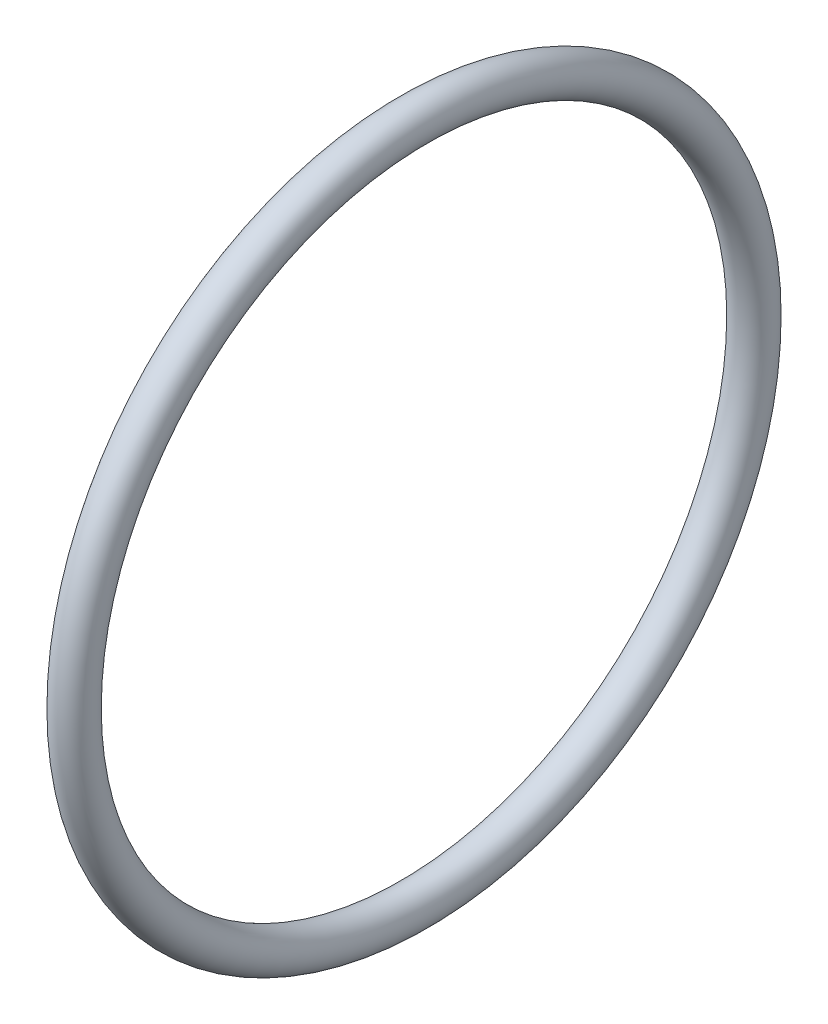
from build123d import *

# Parameters (mm, degrees)
SKETCH1_R = 1.5


with BuildPart() as part:
    # Sketch1 → Revolve1 (revolve)
    with BuildSketch(Plane.XY, mode=Mode.PRIVATE) as revolve1_sk:
        with Locations((0, 27.250060805)):
            Circle(SKETCH1_R)
    revolve(revolve1_sk.sketch.rotate(Axis((-15.014065037, 0.750060805, 0), (1, 0, 0)), 90), axis=Axis((-15.014065037, 0.750060805, 0), (1, 0, 0)))


solid = part.part
